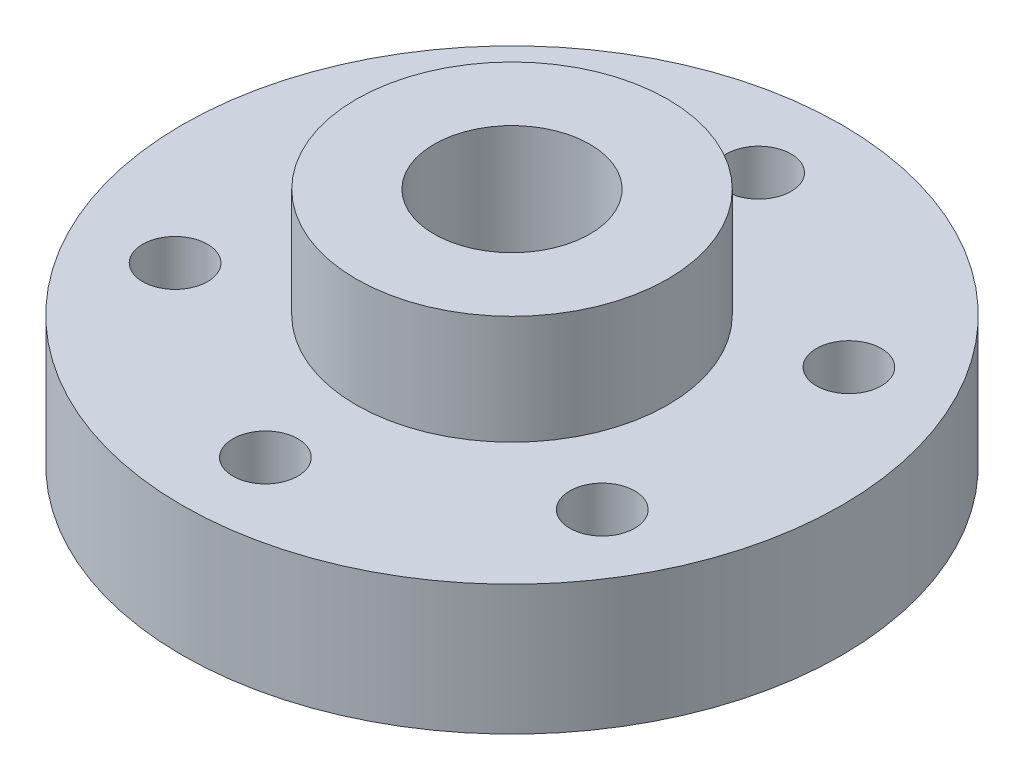
from build123d import *

# Parameters (mm, degrees)
ESQUISSE2_R             = 3
ESQUISSE2_R_2           = 1.25
ENL_V_MAT_EXTRU_1_DEPTH = 21.179692763


with BuildPart() as part:
    # Esquisse1 → Révolution1 (revolve)
    with BuildSketch(Plane(origin=(0, 0, 0), x_dir=(0, 0, -1), z_dir=(1, 0, 0)), mode=Mode.PRIVATE) as r_volution1_sk:
        Polygon((0, 0), (12.7, 0), (12.7, 5), (6, 5), (6, 9.2), (0, 9.2), align=None)
    revolve(r_volution1_sk.sketch.rotate(Axis((0, 9.2, 0), (0, -1, 0)), 180), axis=Axis((0, 9.2, 0), (0, -1, 0)))

    # Esquisse2 → Enlèv. mat.-Extru.1 (cut, through all)
    with BuildSketch(Plane.XZ):
        with Locations(Location((0, 0, 0), (0, 0, 270))):
            Circle(ESQUISSE2_R)
        with Locations(Location((0, 9.5, 0), (0, 0, 270))):
            Circle(ESQUISSE2_R_2)
        with Locations(Location((8.227241336, 4.75, 0), (0, 0, 270))):
            Circle(ESQUISSE2_R_2)
        with Locations(Location((8.227241336, -4.75, 0), (0, 0, 270))):
            Circle(ESQUISSE2_R_2)
        with Locations(Location((0, -9.5, 0), (0, 0, 270))):
            Circle(ESQUISSE2_R_2)
        with Locations(Location((-8.227241336, -4.75, 0), (0, 0, 270))):
            Circle(ESQUISSE2_R_2)
        with Locations(Location((-8.227241336, 4.75, 0), (0, 0, 270))):
            Circle(ESQUISSE2_R_2)
    extrude(amount=-ENL_V_MAT_EXTRU_1_DEPTH, mode=Mode.SUBTRACT)


solid = part.part
